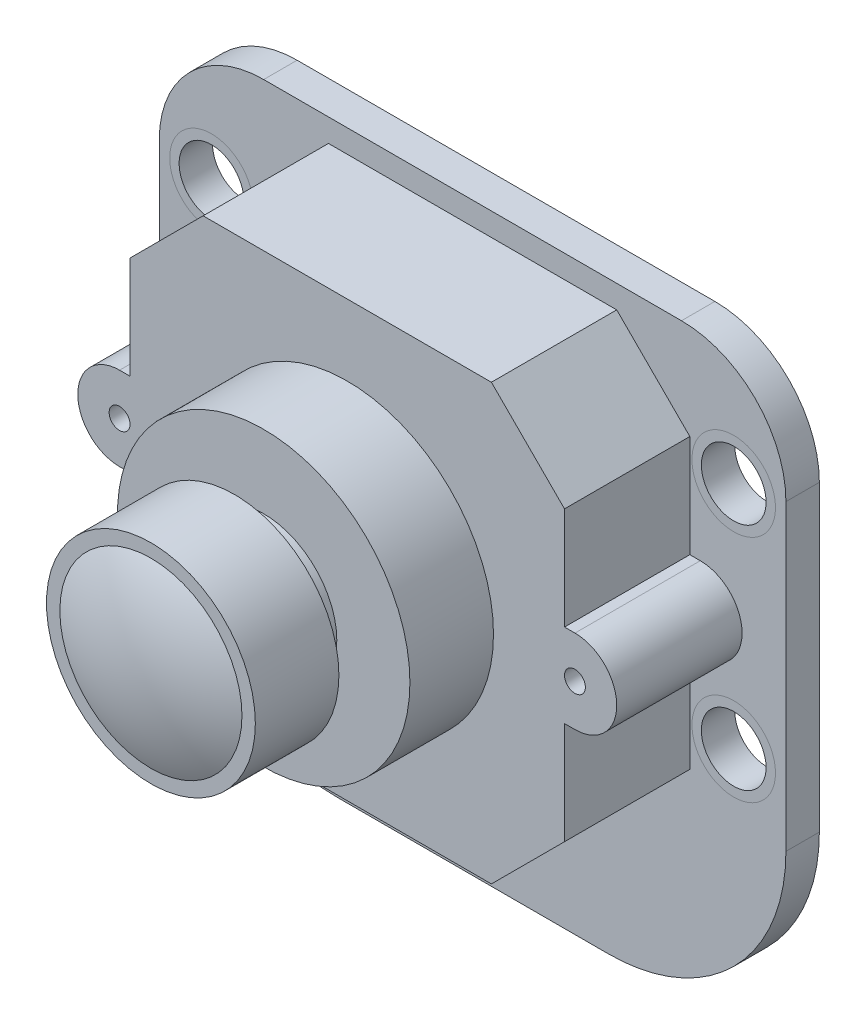
from build123d import *

# Parameters (mm, degrees)
SKETCH_3_R      = 1.55
EXTRUDE_1_DEPTH = 1.6
SKETCH_4_R      = 0.5
EXTRUDE_2_DEPTH = 6
SKETCH_5_R      = 7
EXTRUDE_3_DEPTH = 4
SKETCH_6_R      = 3.5
EXTRUDE_4_DEPTH = 1.4
SKETCH_7_R      = 5
EXTRUDE_5_DEPTH = 4


with BuildPart() as part:
    # 草图3 → 凸台-拉伸1 (new body)
    with BuildSketch(Plane.XY):
        with BuildLine():
            Line((-6.5, -14), (6.5, -14))
            ThreePointArc((6.5, -14), (12.51040764, -11.51040764), (15, -5.5))
            Line((15, -5.5), (15, 9))
            ThreePointArc((15, 9), (13.535533906, 12.535533906), (10, 14))
            Line((10, 14), (-10, 14))
            ThreePointArc((-10, 14), (-13.535533906, 12.535533906), (-15, 9))
            Line((-15, 9), (-15, -5.5))
            ThreePointArc((-15, -5.5), (-12.51040764, -11.51040764), (-6.5, -14))
        make_face()
        with Locations((12.5, 8.5)):
            Circle(SKETCH_3_R, mode=Mode.SUBTRACT)
        with Locations((12.5, -2.5)):
            Circle(SKETCH_3_R, mode=Mode.SUBTRACT)
        with Locations(Location((-12.5, -2.5, 0), (0, 0, 180))):
            Circle(SKETCH_3_R, mode=Mode.SUBTRACT)
        with Locations(Location((-12.5, 8.5, 0), (0, 0, 180))):
            Circle(SKETCH_3_R, mode=Mode.SUBTRACT)
    extrude(amount=EXTRUDE_1_DEPTH)

    # 草图4 → 凸台-拉伸2 (add)
    with BuildSketch(Plane.XY.offset(1.6)):
        with BuildLine():
            Line((-10.4, 9.4), (-6.9, 12.9))
            Line((-6.9, 12.9), (6.9, 12.9))
            Line((6.9, 12.9), (10.4, 9.4))
            Line((10.4, 9.4), (10.4, 4.5))
            Line((10.4, 4.5), (10.9, 4.5))
            ThreePointArc((10.9, 4.5), (12.9, 2.5), (10.9, 0.5))
            Line((10.9, 0.5), (10.4, 0.5))
            Line((10.4, 0.5), (10.4, -4.4))
            Line((10.4, -4.4), (6.9, -7.9))
            Line((6.9, -7.9), (-6.9, -7.9))
            Line((-6.9, -7.9), (-10.4, -4.4))
            Line((-10.4, -4.4), (-10.4, 0.5))
            Line((-10.4, 0.5), (-10.9, 0.5))
            ThreePointArc((-10.9, 0.5), (-12.9, 2.5), (-10.9, 4.5))
            Line((-10.9, 4.5), (-10.4, 4.5))
            Line((-10.4, 4.5), (-10.4, 9.4))
        make_face()
        with Locations((10.9, 2.5)):
            Circle(SKETCH_4_R, mode=Mode.SUBTRACT)
        with Locations((-10.9, 2.5)):
            Circle(SKETCH_4_R, mode=Mode.SUBTRACT)
    extrude(amount=EXTRUDE_2_DEPTH)

    # 草图5 → 凸台-拉伸3 (add)
    with BuildSketch(Plane.XY.offset(7.6)):
        with Locations((0, 2.5)):
            Circle(SKETCH_5_R)
    extrude(amount=EXTRUDE_3_DEPTH)

    # 草图6 → 凸台-拉伸4 (add)
    with BuildSketch(Plane.XY.offset(11.6)):
        with Locations((0, 2.5)):
            Circle(SKETCH_6_R)
    extrude(amount=EXTRUDE_4_DEPTH)

    # 草图7 → 凸台-拉伸5 (add)
    with BuildSketch(Plane.XY.offset(13)):
        with Locations((0, 2.5)):
            Circle(SKETCH_7_R)
    extrude(amount=EXTRUDE_5_DEPTH)

    # 草图8 → 旋转1 (revolve)
    with BuildSketch(Plane(origin=(0, 2.5, 0), x_dir=(1, 0, 0), z_dir=(0, 1, 0))):
        with BuildLine():
            Line((0, -17), (-4.358898944, -17))
            ThreePointArc((-4.358898944, -17), (-2.236067977, -17.746794345), (0, -18))
            Line((0, -18), (0, -17))
        make_face()
    revolve(axis=Axis((0, 2.5, 17), (0, 0, 1)))


solid = part.part
